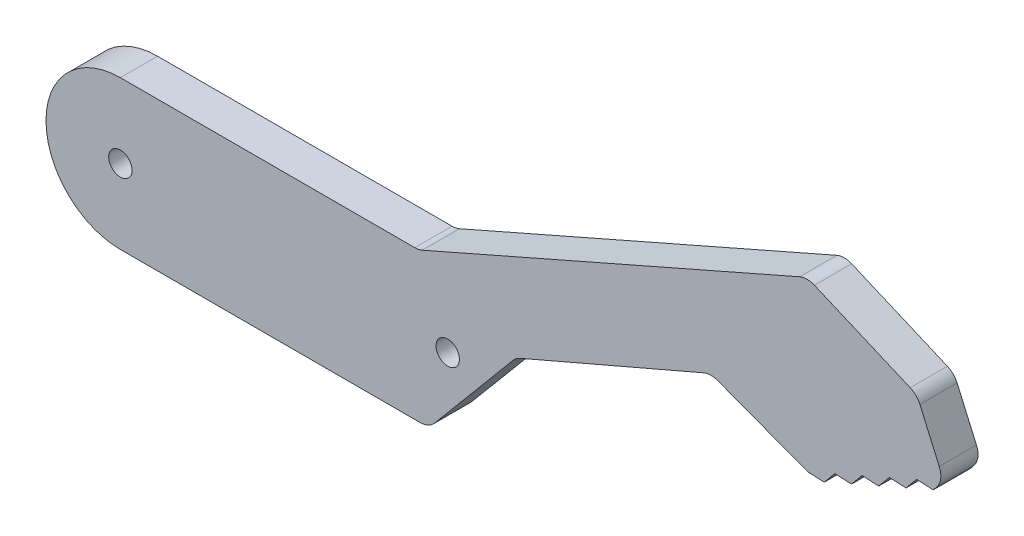
from build123d import *

# Parameters (mm, degrees)
SKETCH1_R           = 3.15
BOSS_EXTRUDE1_DEPTH = 10
FILLET2_R           = 5


with BuildPart() as part:
    # Sketch1 → Boss-Extrude1 (new body)
    with BuildSketch(Plane.XY):
        with BuildLine():
            Line((80.2, 20), (0, 20))
            ThreePointArc((0, 20), (-20, 0), (0, -20))
            Line((0, -20), (82.940545554, -20))
            Line((82.940545554, -20), (106.363301662, 7.92396063))
            Line((106.363301662, 7.92396063), (158.661984796, 30.491400503))
            Line((158.661984796, 30.491400503), (184.755633581, 20.652615644))
            Line((184.755633581, 20.652615644), (189.222179508, 20.429081564))
            Line((189.222179508, 20.429081564), (192.080934328, 23.868197857))
            Line((192.080934328, 23.868197857), (196.547480254, 23.644663777))
            Line((196.547480254, 23.644663777), (199.406235074, 27.08378007))
            Line((199.406235074, 27.08378007), (203.872781001, 26.86024599))
            Line((203.872781001, 26.86024599), (206.731535821, 30.299362284))
            Line((206.731535821, 30.299362284), (211.198081748, 30.075828204))
            Line((211.198081748, 30.075828204), (214.056836568, 33.514944497))
            Line((214.056836568, 33.514944497), (218.523382494, 33.291410417))
            Line((218.523382494, 33.291410417), (221.382137314, 36.73052671))
            Line((221.382137314, 36.73052671), (214.147077335, 53.21245339))
            Line((214.147077335, 53.21245339), (184.585535641, 65.822046539))
            Line((184.585535641, 65.822046539), (80.2, 20))
        make_face()
        Circle(SKETCH1_R, mode=Mode.SUBTRACT)
        with Locations((88, 0)):
            Circle(SKETCH1_R, mode=Mode.SUBTRACT)
    extrude(amount=BOSS_EXTRUDE1_DEPTH)

    # Fillet2
    fillet2_edges = [part.edges().sort_by_distance(p)[0] for p in [
        (82.940545554, -20, 5),
        (80.2, 20, 5),
        (184.585535641, 65.822046539, 5),
        (214.147077335, 53.21245339, 5),
        (221.382137314, 36.73052671, 5),
        (184.755633581, 20.652615644, 5),
        (158.661984796, 30.491400503, 5),
        (106.363301662, 7.92396063, 5),
    ]]
    fillet(fillet2_edges, radius=FILLET2_R)


solid = part.part
